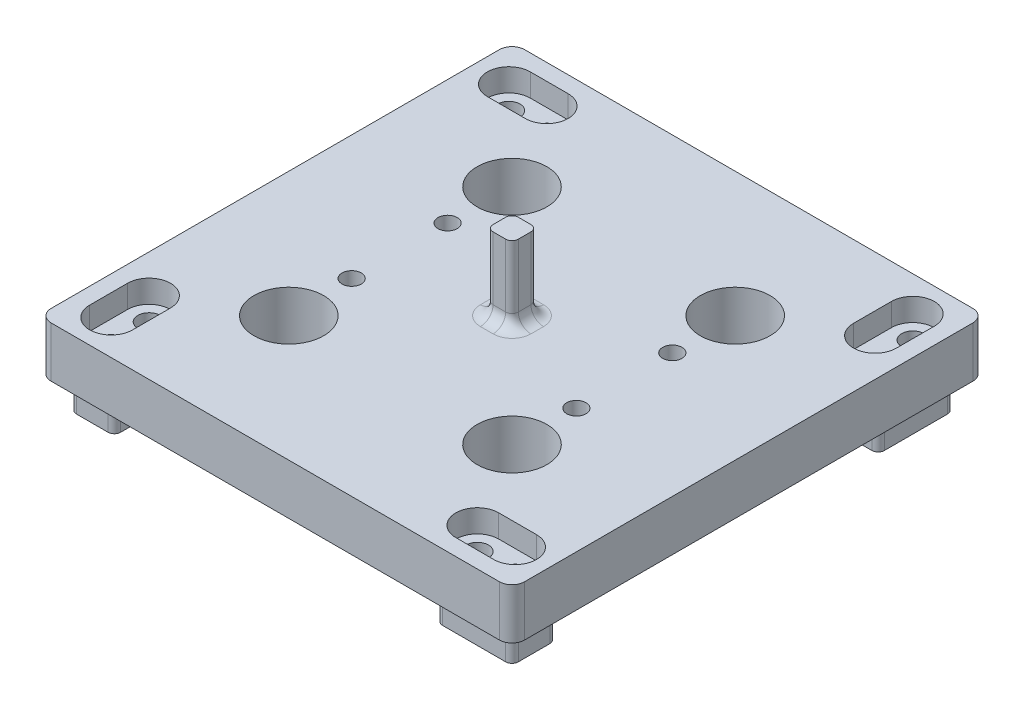
from build123d import *

# Parameters (mm, degrees)
BOSS_EXTRUDE1_DEPTH = 8
SKETCH2_W           = 7
SKETCH2_H           = 12
SKETCH2_R           = 1.775
SKETCH2_W_2         = 12
SKETCH2_H_2         = 7
BOSS_EXTRUDE2_DEPTH = 13
SKETCH7_R           = 1.775
CUT_EXTRUDE1_DEPTH  = 55.603113464
FILLET1_R           = 1
SKETCH9_R           = 1.525
CUT_EXTRUDE3_DEPTH  = 55.603113464
CUT_EXTRUDE4_DEPTH  = 3.6
SKETCH12_R          = 5.525
CUT_EXTRUDE5_DEPTH  = 55.603113464
BOSS_EXTRUDE3_DEPTH = 12
FILLET2_R           = 2


with BuildPart() as part:
    # Sketch1 → Boss-Extrude1 (new body)
    with BuildSketch(Plane(origin=(0, 0, 0), x_dir=(1, 0, 0), z_dir=(0, 1, 0))):
        with BuildLine():
            Line((35.5, -37.5), (-35.5, -37.5))
            ThreePointArc((-35.5, -37.5), (-36.914213562, -36.914213562), (-37.5, -35.5))
            Line((-37.5, -35.5), (-37.5, 35.5))
            ThreePointArc((-37.5, 35.5), (-36.914213562, 36.914213562), (-35.5, 37.5))
            Line((-35.5, 37.5), (35.5, 37.5))
            ThreePointArc((35.5, 37.5), (36.914213562, 36.914213562), (37.5, 35.5))
            Line((37.5, 35.5), (37.5, -35.5))
            ThreePointArc((37.5, -35.5), (36.914213562, -36.914213562), (35.5, -37.5))
        make_face()
    extrude(amount=BOSS_EXTRUDE1_DEPTH)

    # Sketch2 → Boss-Extrude2 (add)
    # profile 1 of 4: a face of its own
    with BuildSketch(Plane(origin=(0, 8, 0), x_dir=(1, 0, 0), z_dir=(0, 1, 0))):
        with Locations((-31.5, -29)):
            Rectangle(SKETCH2_W, SKETCH2_H)
        with Locations(Location((-31.5, -26, 0), (0, 0, 270))):
            Circle(SKETCH2_R, mode=Mode.SUBTRACT)
        with Locations(Location((-31.5, -32, 0), (0, 0, 270))):
            Circle(SKETCH2_R, mode=Mode.SUBTRACT)
    # profile 2 of 4: a face of its own
    with BuildSketch(Plane(origin=(0, 8, 0), x_dir=(1, 0, 0), z_dir=(0, 1, 0))):
        with Locations((29, -31.5)):
            Rectangle(SKETCH2_W_2, SKETCH2_H_2)
        with Locations(Location((26, -31.5, 0), (0, 0, 270))):
            Circle(SKETCH2_R, mode=Mode.SUBTRACT)
        with Locations(Location((32, -31.5, 0), (0, 0, 270))):
            Circle(SKETCH2_R, mode=Mode.SUBTRACT)
    # profile 3 of 4: a face of its own
    with BuildSketch(Plane(origin=(0, 8, 0), x_dir=(1, 0, 0), z_dir=(0, 1, 0))):
        with Locations((31.5, 29)):
            Rectangle(SKETCH2_W, SKETCH2_H)
        with Locations(Location((31.5, 26, 0), (0, 0, 270))):
            Circle(SKETCH2_R, mode=Mode.SUBTRACT)
        with Locations(Location((31.5, 32, 0), (0, 0, 270))):
            Circle(SKETCH2_R, mode=Mode.SUBTRACT)
    # profile 4 of 4: a face of its own
    with BuildSketch(Plane(origin=(0, 8, 0), x_dir=(1, 0, 0), z_dir=(0, 1, 0))):
        with Locations((-29, 31.5)):
            Rectangle(SKETCH2_W_2, SKETCH2_H_2)
        with Locations(Location((-26, 31.5, 0), (0, 0, 270))):
            Circle(SKETCH2_R, mode=Mode.SUBTRACT)
        with Locations(Location((-32, 31.5, 0), (0, 0, 270))):
            Circle(SKETCH2_R, mode=Mode.SUBTRACT)
    extrude(amount=-BOSS_EXTRUDE2_DEPTH)

    # Sketch7 → Cut-Extrude1 (cut, through all)
    with BuildSketch(Plane(origin=(0, 8, 0), x_dir=(1, 0, 0), z_dir=(0, 1, 0))):
        with Locations(Location((32, -31.5, 0), (0, 0, 270))):
            Circle(SKETCH7_R)
        with Locations(Location((26, -31.5, 0), (0, 0, 270))):
            Circle(SKETCH7_R)
        with Locations(Location((-31.5, -32, 0), (0, 0, 270))):
            Circle(SKETCH7_R)
        with Locations(Location((-31.5, -26, 0), (0, 0, 270))):
            Circle(SKETCH7_R)
        with Locations(Location((31.5, 26, 0), (0, 0, 270))):
            Circle(SKETCH7_R)
        with Locations(Location((31.5, 32, 0), (0, 0, 270))):
            Circle(SKETCH7_R)
        with Locations(Location((-26, 31.5, 0), (0, 0, 270))):
            Circle(SKETCH7_R)
        with Locations(Location((-32, 31.5, 0), (0, 0, 270))):
            Circle(SKETCH7_R)
    extrude(amount=-CUT_EXTRUDE1_DEPTH, mode=Mode.SUBTRACT)

    # Fillet1
    fillet1_edges = [part.edges().sort_by_distance(p)[0] for p in [
        (35, -2.5, -35),
        (35, -2.5, -23),
        (28, -2.5, -23),
        (28, -2.5, -35),
        (35, -2.5, 28),
        (35, -2.5, 35),
        (23, -2.5, 35),
        (23, -2.5, 28),
        (-35, -2.5, 35),
        (-35, -2.5, 23),
        (-28, -2.5, 23),
        (-28, -2.5, 35),
        (-35, -2.5, -28),
        (-35, -2.5, -35),
        (-23, -2.5, -35),
        (-23, -2.5, -28),
    ]]
    fillet(fillet1_edges, radius=FILLET1_R)

    # Sketch9 → Cut-Extrude3 (cut, through all)
    with BuildSketch(Plane(origin=(0, 8, 0), x_dir=(1, 0, 0), z_dir=(0, 1, 0))):
        with Locations(Location((-17.8, 7.6, 0), (0, 0, 270))):
            Circle(SKETCH9_R)
        with Locations(Location((17.8, 7.6, 0), (0, 0, 270))):
            Circle(SKETCH9_R)
        with Locations(Location((-17.8, -7.6, 0), (0, 0, 270))):
            Circle(SKETCH9_R)
        with Locations(Location((17.8, -7.6, 0), (0, 0, 270))):
            Circle(SKETCH9_R)
    extrude(amount=-CUT_EXTRUDE3_DEPTH, mode=Mode.SUBTRACT)

    # Sketch11 → Cut-Extrude4 (cut)
    with BuildSketch(Plane(origin=(0, 8, 0), x_dir=(1, 0, 0), z_dir=(0, 1, 0))):
        with BuildLine():
            Line((-32, 34.9), (-26, 34.9))
            ThreePointArc((-26, 34.9), (-22.6, 31.5), (-26, 28.1))
            Line((-26, 28.1), (-32, 28.1))
            ThreePointArc((-32, 28.1), (-35.4, 31.5), (-32, 34.9))
        make_face()
        with BuildLine():
            Line((-28.1, -26), (-28.1, -32))
            ThreePointArc((-28.1, -32), (-31.5, -35.4), (-34.9, -32))
            Line((-34.9, -32), (-34.9, -26))
            ThreePointArc((-34.9, -26), (-31.5, -22.6), (-28.1, -26))
        make_face()
        with BuildLine():
            Line((26, -28.1), (32, -28.1))
            ThreePointArc((32, -28.1), (35.4, -31.5), (32, -34.9))
            Line((32, -34.9), (26, -34.9))
            ThreePointArc((26, -34.9), (22.6, -31.5), (26, -28.1))
        make_face()
        with BuildLine():
            Line((34.9, 32), (34.9, 26))
            ThreePointArc((34.9, 26), (31.5, 22.6), (28.1, 26))
            Line((28.1, 26), (28.1, 32))
            ThreePointArc((28.1, 32), (31.5, 35.4), (34.9, 32))
        make_face()
    extrude(amount=-CUT_EXTRUDE4_DEPTH, mode=Mode.SUBTRACT)

    # Sketch12 → Cut-Extrude5 (cut, through all)
    with BuildSketch(Plane(origin=(0, 8, 0), x_dir=(1, 0, 0), z_dir=(0, 1, 0))):
        with Locations(Location((-17.68, 17.68, 0), (0, 0, 270))):
            Circle(SKETCH12_R)
        with Locations(Location((-17.68, -17.68, 0), (0, 0, 270))):
            Circle(SKETCH12_R)
        with Locations(Location((17.68, -17.68, 0), (0, 0, 270))):
            Circle(SKETCH12_R)
        with Locations(Location((17.68, 17.68, 0), (0, 0, 270))):
            Circle(SKETCH12_R)
    extrude(amount=-CUT_EXTRUDE5_DEPTH, mode=Mode.SUBTRACT)

    # Sketch13 → Boss-Extrude3 (add)
    with BuildSketch(Plane(origin=(0, 8, 0), x_dir=(1, 0, 0), z_dir=(0, 1, 0))):
        with BuildLine():
            Line((1, -2), (-1, -2))
            ThreePointArc((-1, -2), (-1.707106781, -1.707106781), (-2, -1))
            Line((-2, -1), (-2, 1))
            ThreePointArc((-2, 1), (-1.707106781, 1.707106781), (-1, 2))
            Line((-1, 2), (1, 2))
            ThreePointArc((1, 2), (1.707106781, 1.707106781), (2, 1))
            Line((2, 1), (2, -1))
            ThreePointArc((2, -1), (1.707106781, -1.707106781), (1, -2))
        make_face()
    extrude(amount=BOSS_EXTRUDE3_DEPTH)

    # Fillet2
    fillet2_edges = [part.edges().sort_by_distance(p)[0] for p in [
        (-1.707106781, 8, 1.707106781),
        (0, 8, 2),
        (1.707106781, 8, 1.707106781),
        (2, 8, 0),
        (1.707106781, 8, -1.707106781),
        (0, 8, -2),
        (-1.707106781, 8, -1.707106781),
        (-2, 8, 0),
    ]]
    fillet(fillet2_edges, radius=FILLET2_R)


solid = part.part
